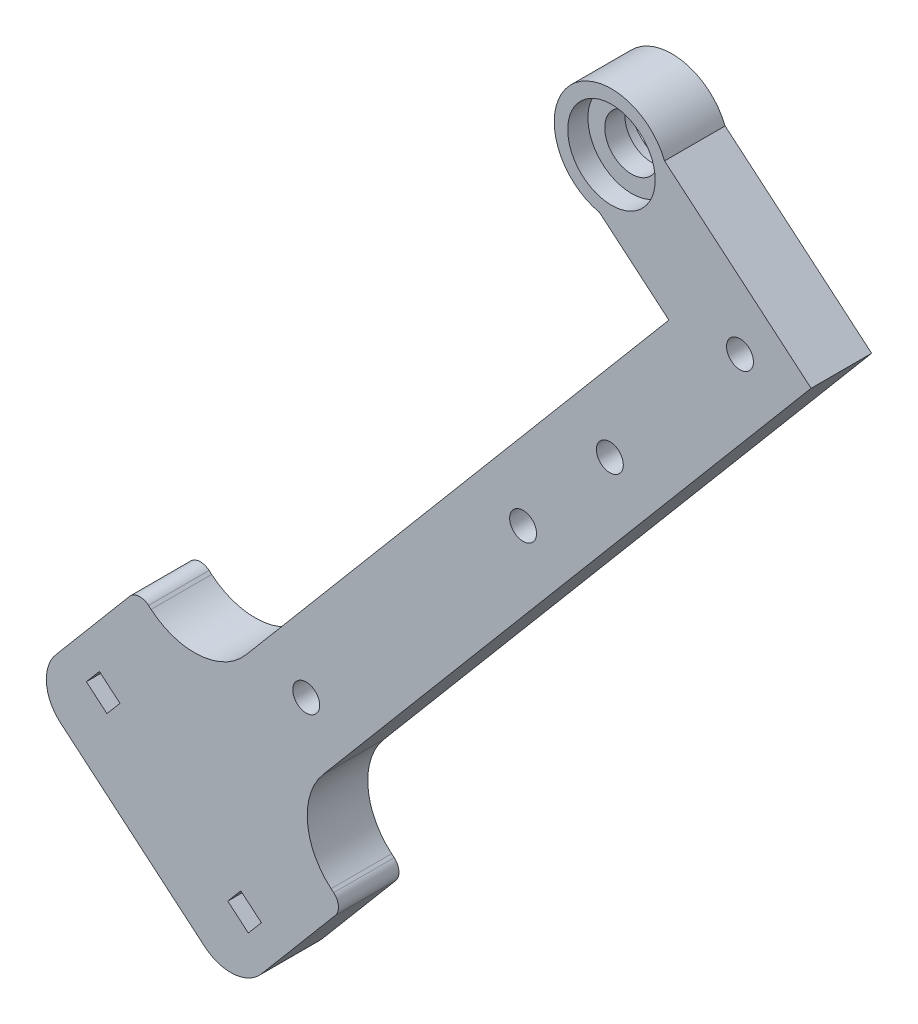
from build123d import *

# Parameters (mm, degrees)
SKETCH2_R           = 2
SKETCH2_R_2         = 6.5
BOSS_EXTRUDE2_DEPTH = 9
BOSS_EXTRUDE5_START = 3
SKETCH2_7_R         = 6.5
SKETCH2_7_R_2       = 4
BOSS_EXTRUDE5_DEPTH = 3


with BuildPart() as part:
    # Sketch2 → Boss-Extrude2 (new body)
    with BuildSketch(Plane.XY):
        with BuildLine():
            Line((-793.550395835, -73.420672293), (-815.334160836, -55.043578334))
            ThreePointArc((-815.334160836, -55.043578334), (-829.724521088, -52.716019141), (-825.006315551, -66.508717808))
            Line((-825.006315551, -66.508717808), (-814.687690024, -75.213657052))
            Line((-814.687690024, -75.213657052), (-877.556695674, -149.737063634))
            ThreePointArc((-877.556695674, -149.737063634), (-884.354900869, -153.253176529), (-891.648225133, -150.932386807))
            Line((-891.648225133, -150.932386807), (-892.030396449, -150.609981649))
            ThreePointArc((-892.030396449, -150.609981649), (-893.489061302, -150.145823705), (-894.848702341, -150.849046284))
            Line((-894.848702341, -150.849046284), (-905.810477685, -163.842871021))
            ThreePointArc((-905.810477685, -163.842871021), (-907.202951518, -168.21886558), (-905.093283782, -172.297788697))
            Line((-905.093283782, -172.297788697), (-883.691690097, -190.352477499))
            ThreePointArc((-883.691690097, -190.352477499), (-879.315695538, -191.744951332), (-875.236772421, -189.635283596))
            Line((-875.236772421, -189.635283596), (-864.274997077, -176.641458858))
            ThreePointArc((-864.274997077, -176.641458858), (-863.810839132, -175.182794005), (-864.514061711, -173.823152966))
            Line((-864.514061711, -173.823152966), (-864.896233027, -173.500747809))
            ThreePointArc((-864.896233027, -173.500747809), (-868.412345922, -166.702542614), (-866.0915562, -159.409218349))
            Line((-866.0915562, -159.409218349), (-793.550395835, -73.420672293))
        make_face()
        Polygon((-898.215030346, -167.633870852), (-901.272400872, -165.054629594), (-899.337969929, -162.761601699), (-896.280599403, -165.340842957), align=None, mode=Mode.SUBTRACT)
        Polygon((-877.195607976, -185.366154496), (-880.252978503, -182.786913239), (-878.31854756, -180.493885344), (-875.261177033, -183.073126602), align=None, mode=Mode.SUBTRACT)
        with Locations((-868.600074365, -150.751427834)):
            Circle(SKETCH2_R, mode=Mode.SUBTRACT)
        with Locations((-836.359558647, -112.534296253)):
            Circle(SKETCH2_R, mode=Mode.SUBTRACT)
        with Locations((-823.46335236, -97.247443621)):
            Circle(SKETCH2_R, mode=Mode.SUBTRACT)
        with Locations((-804.119042929, -74.317164672)):
            Circle(SKETCH2_R, mode=Mode.SUBTRACT)
        with Locations((-823.22760872, -58.196906813)):
            Circle(SKETCH2_R_2, mode=Mode.SUBTRACT)
    extrude(amount=BOSS_EXTRUDE2_DEPTH)

    # Sketch2<7> → Boss-Extrude5 (add)
    with BuildSketch(Plane.XY.offset(BOSS_EXTRUDE5_START)):
        with Locations((-823.22760872, -58.196906813)):
            Circle(SKETCH2_7_R)
        with Locations((-823.22760872, -58.196906813)):
            Circle(SKETCH2_7_R_2, mode=Mode.SUBTRACT)
    extrude(amount=BOSS_EXTRUDE5_DEPTH)


solid = part.part
